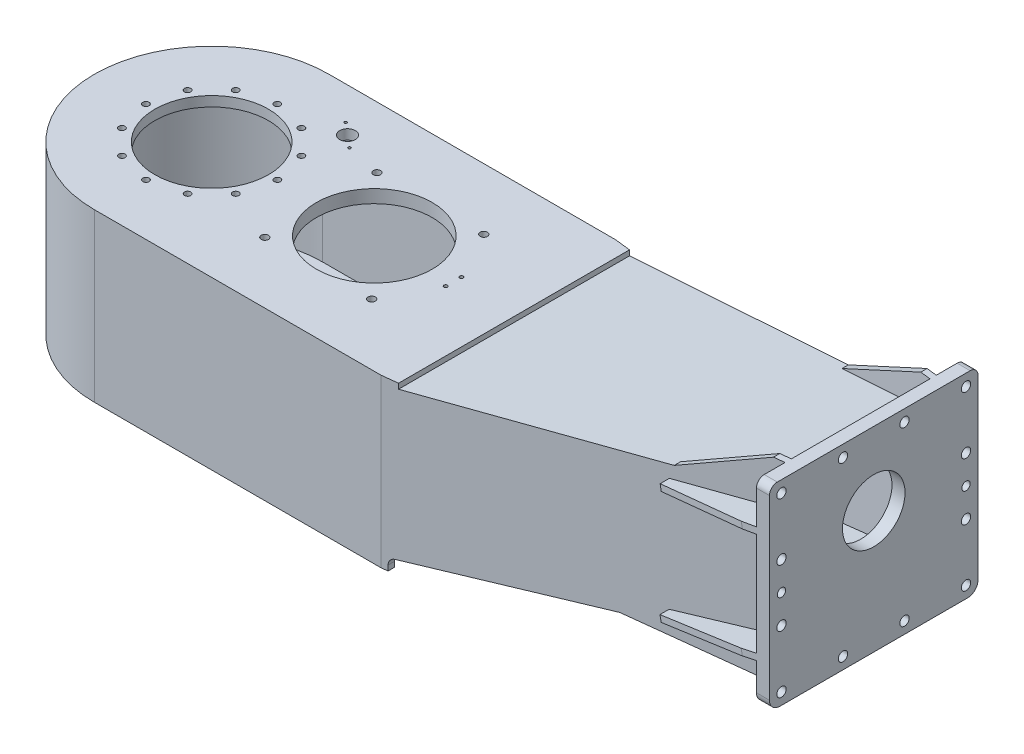
from build123d import *

# Parameters (mm, degrees)
EXTRUDE_1_DEPTH           = 482.5
CUT_EXTRUDE_1_DEPTH       = 1355.051789999
CUT_EXTRUDE_1_DEPTH_BACK  = 1355.051789999
CUT_EXTRUDE_2_DEPTH       = 1355.051789999
CUT_EXTRUDE_2_DEPTH_BACK  = 1355.051789999
EXTRUDE_2_DEPTH           = 19
SKETCH_9_W                = 300
SKETCH_9_H                = 270
EXTRUDE_3_DEPTH           = 7
EXTRUDE_5_DEPTH           = 14
EXTRUDE_6_DEPTH           = 225
EXTRUDE_6_DEPTH_BACK      = 225
SKETCH_15_W               = 16
SKETCH_15_H               = 301
CUT_EXTRUDE_4_DEPTH       = 16
EXTRUDE_7_DEPTH           = 225
EXTRUDE_7_DEPTH_BACK      = 225
EXTRUDE_8_DEPTH           = 225
EXTRUDE_8_DEPTH_BACK      = 225
CUT_EXTRUDE_5_DEPTH       = 1355.051789999
CUT_EXTRUDE_5_DEPTH_BACK  = 1355.051789999
EXTRUDE_22_DEPTH          = 12
EXTRUDE_23_DEPTH          = 12
SKETCH_57_W               = 9
SKETCH_57_H               = 170
EXTRUDE_24_DEPTH          = 35
EXTRUDE_25_DEPTH          = 25
CUT_EXTRUDE_6_DEPTH       = 1325.434218827
CUT_EXTRUDE_6_DEPTH_BACK  = 1325.434218827
SKETCH_59_R               = 109
CUT_EXTRUDE_7_DEPTH       = 1325.434218827
CUT_EXTRUDE_7_DEPTH_BACK  = 1325.434218827
SKETCH_60_R               = 6
CUT_EXTRUDE_8_DEPTH       = 1325.434218827
CUT_EXTRUDE_8_DEPTH_BACK  = 1325.434218827
SKETCH_61_R               = 15
CUT_EXTRUDE_9_DEPTH       = 1325.434218827
CUT_EXTRUDE_9_DEPTH_BACK  = 1325.434218827
SKETCH_62_R               = 2.5
CUT_EXTRUDE_10_DEPTH      = 1324.083519662
CUT_EXTRUDE_10_DEPTH_BACK = 1324.083519662
SKETCH_63_R               = 111
CUT_EXTRUDE_11_DEPTH      = 1324.083519662
CUT_EXTRUDE_11_DEPTH_BACK = 1324.083519662
SKETCH_64_R               = 7
CUT_EXTRUDE_12_DEPTH      = 1324.083519662
CUT_EXTRUDE_12_DEPTH_BACK = 1324.083519662
SKETCH_65_R               = 3.4
SKETCH_67_R               = 9
CUT_EXTRUDE_14_DEPTH      = 25
SKETCH_69_R               = 8
CUT_EXTRUDE_16_DEPTH      = 25
SKETCH_71_R               = 60
CUT_EXTRUDE_18_DEPTH      = 25


with BuildPart() as part:
    # ｽｹｯﾁ1 → ﾎﾞｽ - 押し出し1 (new body)
    with BuildSketch(Plane(origin=(0, 0, 0), x_dir=(1, 0, 0), z_dir=(0, 1, 0))):
        with BuildLine():
            Line((1245, 145), (550, 225))
            Line((550, 225), (0, 225))
            ThreePointArc((0, 225), (-159.099025767, 159.099025767), (-225, 0))
            ThreePointArc((-225, 0), (-159.099025767, -159.099025767), (0, -225))
            Line((0, -225), (550, -225))
            Line((550, -225), (1245, -145))
            Line((1245, -145), (1245, -132.93876259))
            Line((1245, -132.93876259), (549.468, -213))
            Line((549.468, -213), (0, -213))
            ThreePointArc((0, -213), (-150.613744393, -150.613744393), (-213, 0))
            ThreePointArc((-213, 0), (-150.613744393, 150.613744393), (0, 213))
            Line((0, 213), (549.468, 213))
            Line((549.468, 213), (1245, 132.93876259))
            Line((1245, 132.93876259), (1245, 145))
        make_face()
    extrude(amount=EXTRUDE_1_DEPTH)

    # ｽｹｯﾁ2 → ｶｯﾄ - 押し出し1 (cut, two sides: drawn at the far end of the back side and taken through both)
    with BuildSketch(Plane.XY.offset(-CUT_EXTRUDE_1_DEPTH_BACK)):
        Polygon((-240, 500), (-240, 320), (580, 320), (580, 310), (1054.273, 393.309), (1225, 482.5), (1280, 482.5), (1280, 500), align=None)
    extrude(amount=CUT_EXTRUDE_1_DEPTH + CUT_EXTRUDE_1_DEPTH_BACK, mode=Mode.SUBTRACT)

    # ｽｹｯﾁ3 → ｶｯﾄ - 押し出し2 (cut, two sides: drawn at the far end of the back side and taken through both)
    with BuildSketch(Plane.XY.offset(-CUT_EXTRUDE_2_DEPTH_BACK)):
        with BuildLine():
            Line((562, -10), (1280, -10))
            Line((1280, -10), (1280, 107.5))
            Line((1280, 107.5), (960.501, 107.5))
            Line((960.501, 107.5), (574.315, 24.679736107))
            ThreePointArc((574.315, 24.679736107), (565.483164497, 19.532541088), (562, 9.922))
            Line((562, 9.922), (562, -10))
        make_face()
    extrude(amount=CUT_EXTRUDE_2_DEPTH + CUT_EXTRUDE_2_DEPTH_BACK, mode=Mode.SUBTRACT)

    # ｽｹｯﾁ6 → ﾎﾞｽ - 押し出し2 (add)
    with BuildSketch(Plane(origin=(0, 301, 0), x_dir=(1, 0, 0), z_dir=(0, 1, 0))):
        with BuildLine():
            Line((580, 221.54676259), (550, 225))
            Line((550, 225), (0, 225))
            ThreePointArc((0, 225), (-159.099025767, 159.099025767), (-225, 0))
            ThreePointArc((-225, 0), (-159.099025767, -159.099025767), (0, -225))
            Line((0, -225), (550, -225))
            Line((550, -225), (580, -221.54676259))
            Line((580, -221.54676259), (580, 221.54676259))
        make_face()
    extrude(amount=EXTRUDE_2_DEPTH)

    # ｽｹｯﾁ9 → ﾎﾞｽ - 押し出し3 (add)
    with BuildSketch(Plane(origin=(0, 295, 0), x_dir=(1, 0, 0), z_dir=(0, 1, 0))):
        with Locations((325, 0)):
            Rectangle(SKETCH_9_W, SKETCH_9_H)
    extrude(amount=EXTRUDE_3_DEPTH)

    # ｽｹｯﾁ13 → ﾎﾞｽ - 押し出し5 (add)
    with BuildSketch(Plane(origin=(0, 0, 0), x_dir=(1, 0, 0), z_dir=(0, 1, 0))):
        with BuildLine():
            Line((531, 225), (0, 225))
            ThreePointArc((0, 225), (-159.099025767, 159.099025767), (-225, 0))
            ThreePointArc((-225, 0), (-159.099025767, -159.099025767), (0, -225))
            Line((0, -225), (531, -225))
            Line((531, -225), (531, -173))
            Line((531, -173), (0, -173))
            ThreePointArc((0, -173), (-122.329473145, -122.329473145), (-173, 0))
            ThreePointArc((-173, 0), (-122.329473145, 122.329473145), (0, 173))
            Line((0, 173), (531, 173))
            Line((531, 173), (531, 225))
        make_face()
    extrude(amount=EXTRUDE_5_DEPTH)

    # ｽｹｯﾁ15 → ﾎﾞｽ - 押し出し6 (add, two sides: drawn at the far end of the back side and taken through both)
    with BuildSketch(Plane.XY.offset(-EXTRUDE_6_DEPTH_BACK)):
        with Locations((539, 150.5)):
            Rectangle(SKETCH_15_W, SKETCH_15_H)
    extrude(amount=EXTRUDE_6_DEPTH + EXTRUDE_6_DEPTH_BACK)

    # ｽｹｯﾁ17 → ｶｯﾄ - 押し出し4 (cut)
    with BuildSketch(Plane(origin=(531, 0, 0), x_dir=(0, 0, -1), z_dir=(1, 0, 0))):
        with BuildLine():
            Line((155, 99.5), (155, 201))
            ThreePointArc((155, 201), (140.355339059, 236.355339059), (105, 251))
            Line((105, 251), (-105, 251))
            ThreePointArc((-105, 251), (-140.355339059, 236.355339059), (-155, 201))
            Line((-155, 201), (-155, 99.5))
            ThreePointArc((-155, 99.5), (-140.355339059, 64.144660941), (-105, 49.5))
            Line((-105, 49.5), (105, 49.5))
            ThreePointArc((105, 49.5), (140.355339059, 64.144660941), (155, 99.5))
        make_face()
    extrude(amount=CUT_EXTRUDE_4_DEPTH, mode=Mode.SUBTRACT)

    # ｽｹｯﾁ18 → ﾎﾞｽ - 押し出し7 (add, two sides: drawn at the far end of the back side and taken through both)
    with BuildSketch(Plane.XY.offset(-EXTRUDE_7_DEPTH_BACK)):
        Polygon((580, 297.816275806), (1245, 414.627658701), (1245, 426.811382896), (580, 310), align=None)
    extrude(amount=EXTRUDE_7_DEPTH + EXTRUDE_7_DEPTH_BACK)

    # ｽｹｯﾁ19 → ﾎﾞｽ - 押し出し8 (add, two sides: drawn at the far end of the back side and taken through both)
    with BuildSketch(Plane.XY.offset(-EXTRUDE_8_DEPTH_BACK)):
        Polygon((547, 18.83000083), (1245, 168.50953963), (1245, 177.714145349), (547, 28.034606549), align=None)
    extrude(amount=EXTRUDE_8_DEPTH + EXTRUDE_8_DEPTH_BACK)

    # ｽｹｯﾁ20 → ｶｯﾄ - 押し出し5 (cut, two sides: drawn at the far end of the back side and taken through both)
    with BuildSketch(Plane(origin=(0, 0, 0), x_dir=(1, 0, 0), z_dir=(0, 1, 0)).offset(-CUT_EXTRUDE_5_DEPTH_BACK)):
        Polygon((550, 225), (1250, 144.424460432), (1250, 245), (550, 245), align=None)
        Polygon((550, -225), (1250, -144.424460432), (1250, -245), (550, -245), align=None)
    extrude(amount=CUT_EXTRUDE_5_DEPTH + CUT_EXTRUDE_5_DEPTH_BACK, mode=Mode.SUBTRACT)

    # ｽｹｯﾁ51 → ﾎﾞｽ - 押し出し22 (add)
    with BuildSketch(Plane(origin=(-29.338955803, 167.024866288, 0), x_dir=(0.9849205225581176, 0.1730074109506429, 0), z_dir=(-0.1730074109506429, 0.9849205225581176, 0))):
        Polygon((1093.872988863, 161.671769784), (1093.872988863, 185.671769784), (1266.47574828, 200), (1314.155737603, 200), (1314.155737603, 136.697841727), align=None)
        Polygon((1093.872988863, -161.671769784), (1093.872988863, -185.671769784), (1266.47574828, -200), (1314.155737603, -200), (1314.155737603, -136.697841727), align=None)
    extrude(amount=EXTRUDE_22_DEPTH)

    # ｽｹｯﾁ54 → ﾎﾞｽ - 押し出し23 (add)
    with BuildSketch(Plane(origin=(17.64058177, -82.263255044, 0), x_dir=(-0.9777713760477191, -0.20967388054249855, 0), z_dir=(0.20967388054249853, -0.977771376047719, 0))):
        Polygon((-1053.823463717, 161.671769784), (-1053.823463717, 185.671769784), (-1227.688238413, 200), (-1275.716848321, 200), (-1275.716848321, 136.697841727), align=None)
        Polygon((-1053.823463717, -161.671769784), (-1053.823463717, -185.671769784), (-1227.688238413, -200), (-1275.716848321, -200), (-1275.716848321, -136.697841727), align=None)
    extrude(amount=-EXTRUDE_23_DEPTH)

    # ｽｹｯﾁ57 → ﾎﾞｽ - 押し出し24 (add)
    with BuildSketch(Plane(origin=(1235, 0, 0), x_dir=(0, 0, -1), z_dir=(1, 0, 0))):
        with Locations((138.5, 295)):
            Rectangle(SKETCH_57_W, SKETCH_57_H)
        with Locations((-138.5, 295)):
            Rectangle(SKETCH_57_W, SKETCH_57_H)
    extrude(amount=EXTRUDE_24_DEPTH)

    # ｽｹｯﾁ58 → ﾎﾞｽ - 押し出し25 (add)
    with BuildSketch(Plane(origin=(1245, 0, 0), x_dir=(0, 0, -1), z_dir=(1, 0, 0))):
        with BuildLine():
            Line((200, 127.5), (200, 467.5))
            ThreePointArc((200, 467.5), (195.606601718, 478.106601718), (185, 482.5))
            Line((185, 482.5), (-185, 482.5))
            ThreePointArc((-185, 482.5), (-195.606601718, 478.106601718), (-200, 467.5))
            Line((-200, 467.5), (-200, 127.5))
            ThreePointArc((-200, 127.5), (-194.142135624, 113.357864376), (-180, 107.5))
            Line((-180, 107.5), (180, 107.5))
            ThreePointArc((180, 107.5), (194.142135624, 113.357864376), (200, 127.5))
        make_face()
    extrude(amount=EXTRUDE_25_DEPTH)

    # ｽｹｯﾁ59 → ｶｯﾄ - 押し出し6 (cut, two sides: drawn at the far end of the back side and taken through both)
    with BuildSketch(Plane(origin=(0, 301, 0), x_dir=(1, 0, 0), z_dir=(0, 1, 0)).offset(-CUT_EXTRUDE_6_DEPTH_BACK)):
        with Locations(Location((0, 0, 0), (0, 0, 270))):
            Circle(SKETCH_59_R)
    extrude(amount=CUT_EXTRUDE_6_DEPTH + CUT_EXTRUDE_6_DEPTH_BACK, mode=Mode.SUBTRACT)

    # ｽｹｯﾁ60 → ｶｯﾄ - 押し出し7 (cut, two sides: drawn at the far end of the back side and taken through both)
    with BuildSketch(Plane(origin=(0, 301, 0), x_dir=(1, 0, 0), z_dir=(0, 1, 0)).offset(-CUT_EXTRUDE_7_DEPTH_BACK)):
        with Locations(Location((126, 0, 0), (0, 0, 270))):
            Circle(SKETCH_60_R)
        with Locations(Location((109.119200877, 63, 0), (0, 0, 270))):
            Circle(SKETCH_60_R)
        with Locations(Location((63, 109.119200877, 0), (0, 0, 270))):
            Circle(SKETCH_60_R)
        with Locations(Location((0, 126, 0), (0, 0, 270))):
            Circle(SKETCH_60_R)
        with Locations(Location((-63, 109.119200877, 0), (0, 0, 270))):
            Circle(SKETCH_60_R)
        with Locations(Location((-109.119200877, 63, 0), (0, 0, 270))):
            Circle(SKETCH_60_R)
        with Locations(Location((-126, 0, 0), (0, 0, 270))):
            Circle(SKETCH_60_R)
        with Locations(Location((-109.119200877, -63, 0), (0, 0, 270))):
            Circle(SKETCH_60_R)
        with Locations(Location((-63, -109.119200877, 0), (0, 0, 270))):
            Circle(SKETCH_60_R)
        with Locations(Location((0, -126, 0), (0, 0, 270))):
            Circle(SKETCH_60_R)
        with Locations(Location((63, -109.119200877, 0), (0, 0, 270))):
            Circle(SKETCH_60_R)
        with Locations(Location((109.119200877, -63, 0), (0, 0, 270))):
            Circle(SKETCH_60_R)
    extrude(amount=CUT_EXTRUDE_7_DEPTH + CUT_EXTRUDE_7_DEPTH_BACK, mode=Mode.SUBTRACT)

    # ｽｹｯﾁ61 → ｶｯﾄ - 押し出し8 (cut, two sides: drawn at the far end of the back side and taken through both)
    with BuildSketch(Plane(origin=(0, 301, 0), x_dir=(1, 0, 0), z_dir=(0, 1, 0)).offset(-CUT_EXTRUDE_8_DEPTH_BACK)):
        with Locations(Location((118.93, 141.718, 0), (0, 0, 270))):
            Circle(SKETCH_61_R)
    extrude(amount=CUT_EXTRUDE_8_DEPTH + CUT_EXTRUDE_8_DEPTH_BACK, mode=Mode.SUBTRACT)

    # ｽｹｯﾁ62 → ｶｯﾄ - 押し出し9 (cut, two sides: drawn at the far end of the back side and taken through both)
    with BuildSketch(Plane(origin=(0, 301, 0), x_dir=(1, 0, 0), z_dir=(0, 1, 0)).offset(-CUT_EXTRUDE_9_DEPTH_BACK)):
        with Locations(Location((141.898, 122.435, 0), (0, 0, 270))):
            Circle(SKETCH_62_R)
        with Locations(Location((95.935, 161.002, 0), (0, 0, 270))):
            Circle(SKETCH_62_R)
    extrude(amount=CUT_EXTRUDE_9_DEPTH + CUT_EXTRUDE_9_DEPTH_BACK, mode=Mode.SUBTRACT)

    # ｽｹｯﾁ63 → ｶｯﾄ - 押し出し10 (cut, two sides: drawn at the far end of the back side and taken through both)
    with BuildSketch(Plane(origin=(0, 295, 0), x_dir=(1, 0, 0), z_dir=(0, 1, 0)).offset(-CUT_EXTRUDE_10_DEPTH_BACK)):
        with Locations(Location((312, 0, 0), (0, 0, 270))):
            Circle(SKETCH_63_R)
    extrude(amount=CUT_EXTRUDE_10_DEPTH + CUT_EXTRUDE_10_DEPTH_BACK, mode=Mode.SUBTRACT)

    # ｽｹｯﾁ64 → ｶｯﾄ - 押し出し11 (cut, two sides: drawn at the far end of the back side and taken through both)
    with BuildSketch(Plane(origin=(0, 295, 0), x_dir=(1, 0, 0), z_dir=(0, 1, 0)).offset(-CUT_EXTRUDE_11_DEPTH_BACK)):
        with Locations(Location((209.5, 107.5, 0), (0, 0, 270))):
            Circle(SKETCH_64_R)
        with Locations(Location((209.5, -107.5, 0), (0, 0, 270))):
            Circle(SKETCH_64_R)
        with Locations(Location((414.5, 107.5, 0), (0, 0, 270))):
            Circle(SKETCH_64_R)
        with Locations(Location((414.5, -107.5, 0), (0, 0, 270))):
            Circle(SKETCH_64_R)
    extrude(amount=CUT_EXTRUDE_11_DEPTH + CUT_EXTRUDE_11_DEPTH_BACK, mode=Mode.SUBTRACT)

    # ｽｹｯﾁ65 → ｶｯﾄ - 押し出し12 (cut, two sides: drawn at the far end of the back side and taken through both)
    with BuildSketch(Plane(origin=(0, 295, 0), x_dir=(1, 0, 0), z_dir=(0, 1, 0)).offset(-CUT_EXTRUDE_12_DEPTH_BACK)):
        with Locations(Location((464, 15, 0), (0, 0, 270))):
            Circle(SKETCH_65_R)
        with Locations(Location((464, -15, 0), (0, 0, 270))):
            Circle(SKETCH_65_R)
    extrude(amount=CUT_EXTRUDE_12_DEPTH + CUT_EXTRUDE_12_DEPTH_BACK, mode=Mode.SUBTRACT)

    # ｽｹｯﾁ67 → ｶｯﾄ - 押し出し14 (cut)
    with BuildSketch(Plane(origin=(1245, 0, 0), x_dir=(0, 0, -1), z_dir=(1, 0, 0))):
        with Locations((177, 130)):
            Circle(SKETCH_67_R)
        with Locations((177, 240)):
            Circle(SKETCH_67_R)
        with Locations((177, 350)):
            Circle(SKETCH_67_R)
        with Locations((177, 460)):
            Circle(SKETCH_67_R)
        with Locations((-177, 130)):
            Circle(SKETCH_67_R)
        with Locations((-177, 240)):
            Circle(SKETCH_67_R)
        with Locations((-177, 350)):
            Circle(SKETCH_67_R)
        with Locations((-177, 460)):
            Circle(SKETCH_67_R)
        with Locations((59, 130)):
            Circle(SKETCH_67_R)
        with Locations((59, 460)):
            Circle(SKETCH_67_R)
        with Locations((-59, 130)):
            Circle(SKETCH_67_R)
        with Locations((-59, 460)):
            Circle(SKETCH_67_R)
    extrude(amount=CUT_EXTRUDE_14_DEPTH, mode=Mode.SUBTRACT)

    # ｽｹｯﾁ69 → ｶｯﾄ - 押し出し16 (cut)
    with BuildSketch(Plane(origin=(1245, 0, 0), x_dir=(0, 0, -1), z_dir=(1, 0, 0))):
        with Locations((177, 295)):
            Circle(SKETCH_69_R)
        with Locations((-177, 295)):
            Circle(SKETCH_69_R)
    extrude(amount=CUT_EXTRUDE_16_DEPTH, mode=Mode.SUBTRACT)

    # ｽｹｯﾁ71 → ｶｯﾄ - 押し出し18 (cut)
    with BuildSketch(Plane(origin=(1245, 0, 0), x_dir=(0, 0, -1), z_dir=(1, 0, 0))):
        with Locations((0, 342.5)):
            Circle(SKETCH_71_R)
    extrude(amount=CUT_EXTRUDE_18_DEPTH, mode=Mode.SUBTRACT)


solid = part.part
